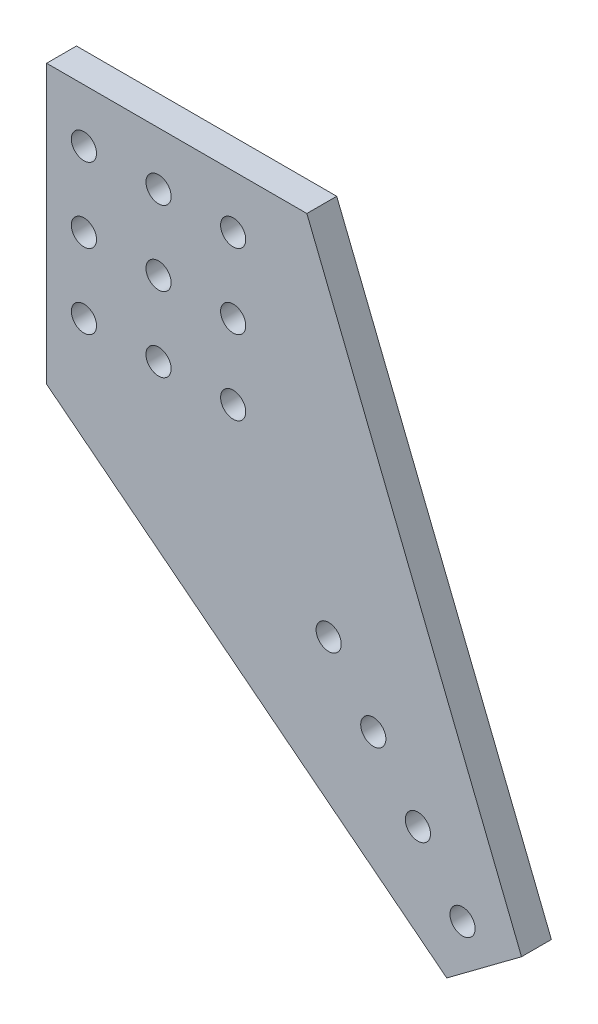
from build123d import *

# Parameters (mm, degrees)
SKETCH_1_R      = 13.5
EXTRUDE_1_DEPTH = 32


with BuildPart() as part:
    # 草图1 → 凸台-拉伸1 (new body)
    with BuildSketch(Plane(origin=(0, 0, 0), x_dir=(1, 0, 0), z_dir=(0, 0, -1))):
        Polygon((-120, 161), (-120, -137), (159, -137), (389.128205194, 438), (308.974573373, 497.794609338), align=None)
        with Locations(Location((0, 0, 0), (0, 0, 180))):
            Circle(SKETCH_1_R, mode=Mode.SUBTRACT)
        with Locations(Location((182.373558482, 244.468577054, 0), (0, 0, 180))):
            Circle(SKETCH_1_R, mode=Mode.SUBTRACT)
        with Locations(Location((230.209245953, 308.59148251, 0), (0, 0, 180))):
            Circle(SKETCH_1_R, mode=Mode.SUBTRACT)
        with Locations(Location((278.044933423, 372.714387967, 0), (0, 0, 180))):
            Circle(SKETCH_1_R, mode=Mode.SUBTRACT)
        with Locations(Location((325.880620894, 436.837293424, 0), (0, 0, 180))):
            Circle(SKETCH_1_R, mode=Mode.SUBTRACT)
        with Locations(Location((-80, 0, 0), (0, 0, 180))):
            Circle(SKETCH_1_R, mode=Mode.SUBTRACT)
        with Locations(Location((80, 0, 0), (0, 0, 180))):
            Circle(SKETCH_1_R, mode=Mode.SUBTRACT)
        with Locations(Location((-80, -80, 0), (0, 0, 180))):
            Circle(SKETCH_1_R, mode=Mode.SUBTRACT)
        with Locations(Location((0, -80, 0), (0, 0, 180))):
            Circle(SKETCH_1_R, mode=Mode.SUBTRACT)
        with Locations(Location((80, -80, 0), (0, 0, 180))):
            Circle(SKETCH_1_R, mode=Mode.SUBTRACT)
        with Locations(Location((-80, 80, 0), (0, 0, 180))):
            Circle(SKETCH_1_R, mode=Mode.SUBTRACT)
        with Locations(Location((0, 80, 0), (0, 0, 180))):
            Circle(SKETCH_1_R, mode=Mode.SUBTRACT)
        with Locations(Location((80, 80, 0), (0, 0, 180))):
            Circle(SKETCH_1_R, mode=Mode.SUBTRACT)
    extrude(amount=EXTRUDE_1_DEPTH)


solid = part.part
